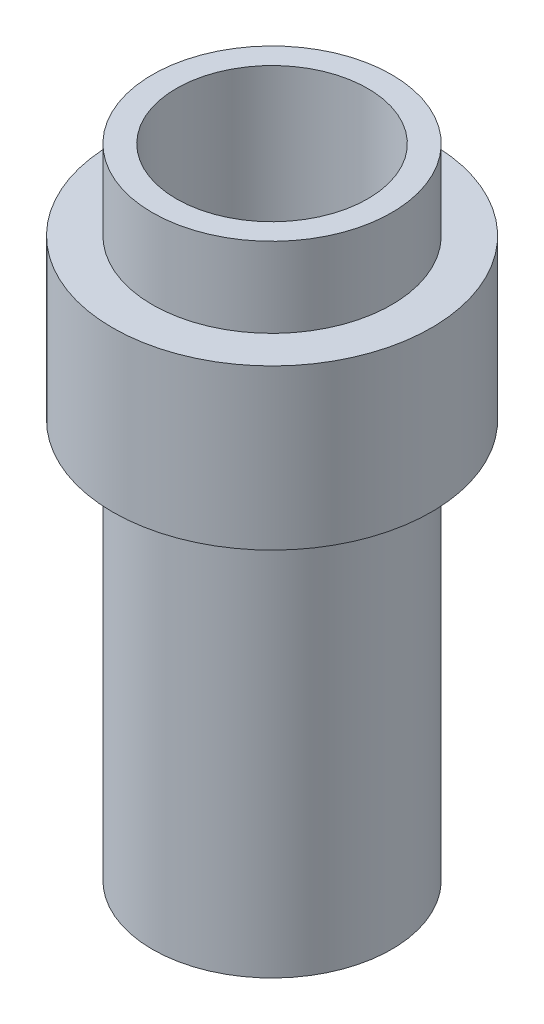
from build123d import *

# Parameters (mm, degrees)
SKETCH1_R           = 7.5
SKETCH1_R_2         = 6
BOSS_EXTRUDE1_DEPTH = 40
BOSS_EXTRUDE2_START = -15
SKETCH2_R           = 10
SKETCH2_R_2         = 7.5
BOSS_EXTRUDE2_DEPTH = 10


with BuildPart() as part:
    # Sketch1 → Boss-Extrude1 (new body)
    with BuildSketch(Plane(origin=(0, 0, 0), x_dir=(1, 0, 0), z_dir=(0, 1, 0))):
        with Locations(Location((0, 0, 0), (0, 0, 270))):
            Circle(SKETCH1_R)
        with Locations(Location((0, 0, 0), (0, 0, 270))):
            Circle(SKETCH1_R_2, mode=Mode.SUBTRACT)
    extrude(amount=BOSS_EXTRUDE1_DEPTH)

    # Sketch2 → Boss-Extrude2 (add)
    with BuildSketch(Plane(origin=(0, 40, 0), x_dir=(1, 0, 0), z_dir=(0, 1, 0)).offset(BOSS_EXTRUDE2_START)):
        with Locations(Location((0, 0, 0), (0, 0, 270))):
            Circle(SKETCH2_R)
        with Locations(Location((0, 0, 0), (0, 0, 270))):
            Circle(SKETCH2_R_2, mode=Mode.SUBTRACT)
    extrude(amount=BOSS_EXTRUDE2_DEPTH)


solid = part.part
